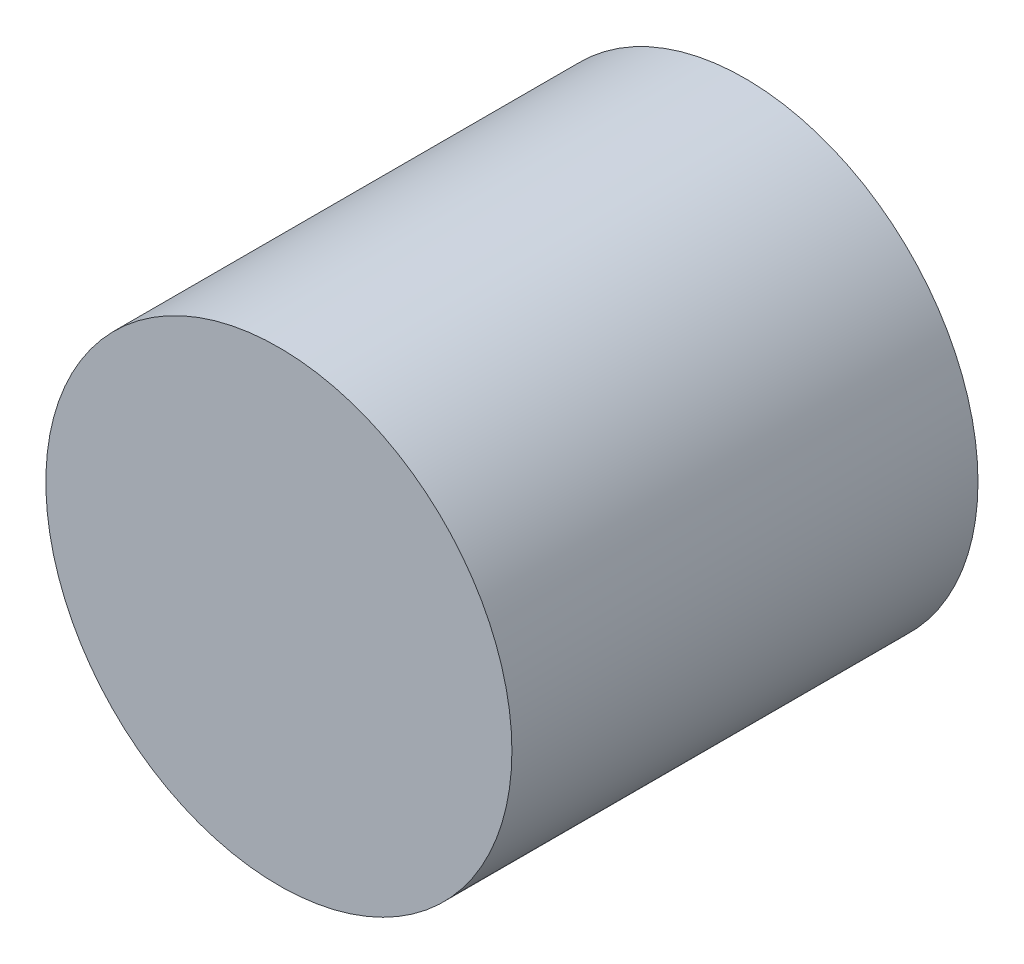
from build123d import *

# Parameters (mm, degrees)
SKETCH1_R           = 7.5
BOSS_EXTRUDE1_DEPTH = 15


with BuildPart() as part:
    # Sketch1 → Boss-Extrude1 (new body)
    with BuildSketch(Plane.XY):
        Circle(SKETCH1_R)
    extrude(amount=BOSS_EXTRUDE1_DEPTH)


solid = part.part
